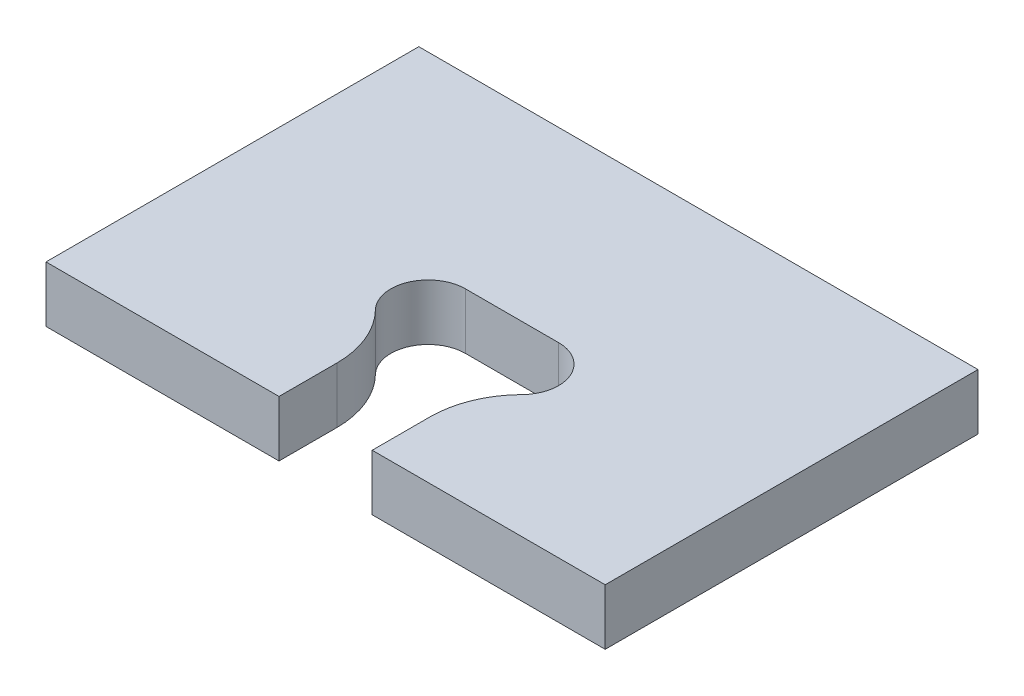
from build123d import *

# Parameters (mm, degrees)
BOSS_EXTRUDE1_DEPTH = 3


with BuildPart() as part:
    # Sketch1 → Boss-Extrude1 (new body)
    with BuildSketch(Plane(origin=(0, 0, 0), x_dir=(1, 0, 0), z_dir=(0, 1, 0))):
        with BuildLine():
            Line((-2.5, 0), (-2.5, 3.101020514))
            ThreePointArc((-2.5, 3.101020514), (-2.870899501, 4.990842879), (-3.928571429, 6.600291576))
            ThreePointArc((-3.928571429, 6.600291576), (-4.343829825, 8.774784858), (-2.5, 10))
            Line((-2.5, 10), (2.5, 10))
            ThreePointArc((2.5, 10), (4.343829825, 8.774784858), (3.928571429, 6.600291576))
            ThreePointArc((3.928571429, 6.600291576), (2.870899501, 4.990842879), (2.5, 3.101020514))
            Line((2.5, 3.101020514), (2.5, 0))
            Line((2.5, 0), (15, 0))
            Line((15, 0), (15, 20))
            Line((15, 20), (-15, 20))
            Line((-15, 20), (-15, 0))
            Line((-15, 0), (-2.5, 0))
        make_face()
    extrude(amount=BOSS_EXTRUDE1_DEPTH)


solid = part.part
